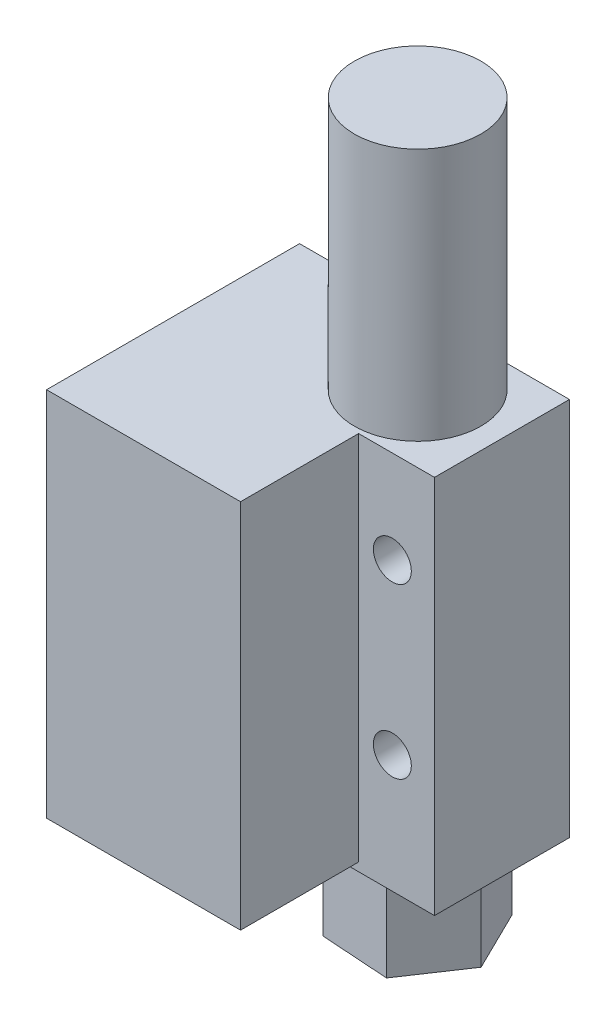
from build123d import *

# Parameters (mm, degrees)
SKETCH_1_W          = 32
SKETCH_1_H          = 45
EXTRUDE_1_DEPTH     = 16
CUT_EXTRUDE_1_REACH = 33.91
SKETCH_2_R          = 2.25
SKETCH_3_R          = 7.5
EXTRUDE_2_DEPTH     = 30
SKETCH_4_W          = 23
SKETCH_4_H          = 44
EXTRUDE_3_DEPTH     = 14
EXTRUDE_4_DEPTH     = 10
SKETCH_6_R          = 4.527091975
CUT_EXTRUDE_2_DEPTH = 10
SKETCH_7_R          = 4
CUT_EXTRUDE_3_DEPTH = 10


with BuildPart() as part:
    # 草图1 → 凸台-拉伸1 (new body)
    with BuildSketch(Plane.XY):
        Rectangle(SKETCH_1_W, SKETCH_1_H)
    extrude(amount=EXTRUDE_1_DEPTH)

    # 草图2 → 切除-拉伸1 (cut, up to next)
    with BuildSketch(Plane(origin=(0, 0, 0), x_dir=(-1, 0, 0), z_dir=(0, 0, -1)), mode=Mode.PRIVATE) as cut_extrude_1_sk1:
        with Locations((-11, 11.5)):
            Circle(SKETCH_2_R)
    cut_extrude_1_tool1 = extrude(cut_extrude_1_sk1.sketch, amount=-CUT_EXTRUDE_1_REACH, mode=Mode.PRIVATE) & part.part
    # 草图2 → 切除-拉伸1 (cut, up to next)
    with BuildSketch(Plane(origin=(0, 0, 0), x_dir=(-1, 0, 0), z_dir=(0, 0, -1)), mode=Mode.PRIVATE) as cut_extrude_1_sk2:
        with Locations((-11, -8.5)):
            Circle(SKETCH_2_R)
    cut_extrude_1_tool2 = extrude(cut_extrude_1_sk2.sketch, amount=-CUT_EXTRUDE_1_REACH, mode=Mode.PRIVATE) & part.part
    add(cut_extrude_1_tool1.solids().sort_by_distance((11, 11.5, 0))[0], mode=Mode.SUBTRACT)
    add(cut_extrude_1_tool2.solids().sort_by_distance((11, -8.5, 0))[0], mode=Mode.SUBTRACT)

    # 草图3 → 凸台-拉伸2 (add)
    with BuildSketch(Plane(origin=(0, 22.5, 0), x_dir=(1, 0, 0), z_dir=(0, 1, 0))):
        with Locations(Location((6, -8, 0), (0, 0, 90))):
            Circle(SKETCH_3_R)
    extrude(amount=EXTRUDE_2_DEPTH)

    # 草图4 → 凸台-拉伸3 (add)
    with BuildSketch(Plane.XY.offset(16)):
        with Locations((-4.5, 0.5)):
            Rectangle(SKETCH_4_W, SKETCH_4_H)
    extrude(amount=EXTRUDE_3_DEPTH)

    # 草图5 → 凸台-拉伸4 (add)
    with BuildSketch(Plane.XZ.offset(22.5)):
        Polygon((10.501026547, 1.286275746), (14.064769031, 8.541141206), (9.563742484, 15.25486546), (1.498973453, 14.713724254), (-2.064769031, 7.458858794), (2.436257516, 0.74513454), align=None)
    extrude(amount=EXTRUDE_4_DEPTH)

    # 草图6 → 切除-拉伸2 (cut)
    with BuildSketch(Plane.XZ.offset(32.5)):
        with Locations(Location((5.995920122, 7.997264761, 0), (0, 0, 270))):
            Circle(SKETCH_6_R)
    extrude(amount=-CUT_EXTRUDE_2_DEPTH, mode=Mode.SUBTRACT)

    # 草图7 → 切除-拉伸3 (cut)
    with BuildSketch(Plane.ZY.offset(16)):
        with Locations(Location((8, -10.5, 0), (0, 0, 270))):
            Circle(SKETCH_7_R)
    extrude(amount=-CUT_EXTRUDE_3_DEPTH, mode=Mode.SUBTRACT)


solid = part.part
